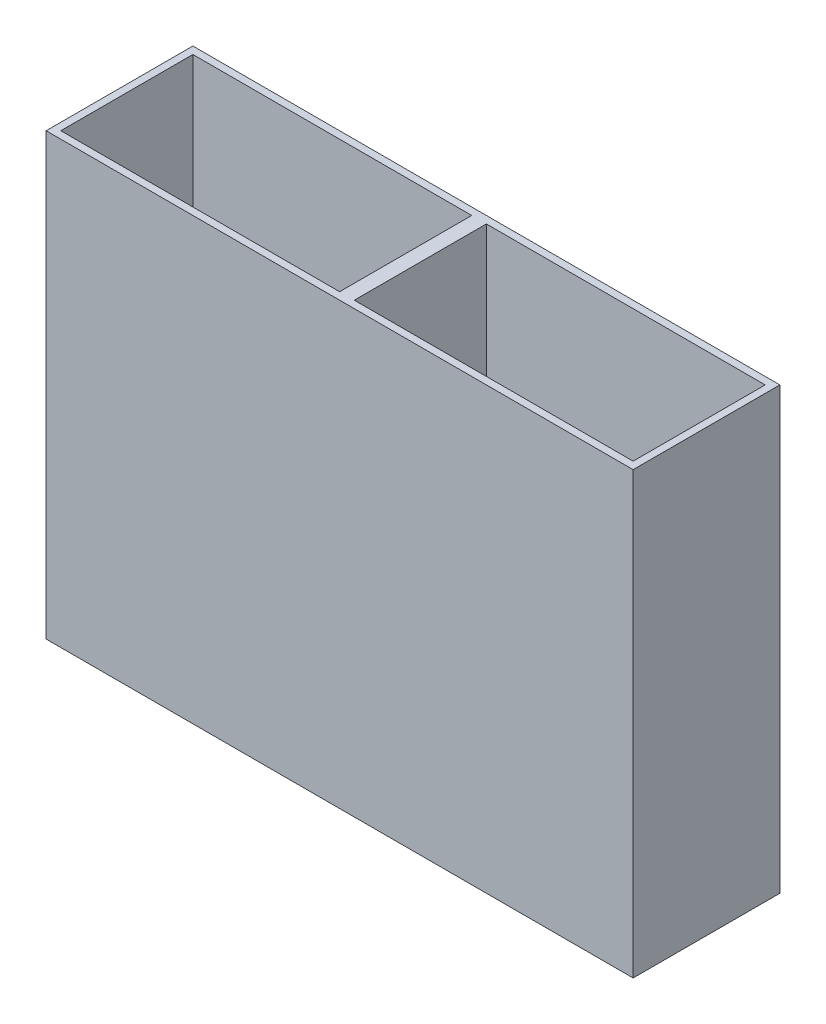
from build123d import *

# Parameters (mm, degrees)
SKETCH1_W           = 508
SKETCH1_H           = 127
BOSS_EXTRUDE1_DEPTH = 381
SKETCH2_W           = 241.3
SKETCH2_H           = 114.3
CUT_EXTRUDE1_DEPTH  = 379.73


with BuildPart() as part:
    # Sketch1 → Boss-Extrude1 (new body)
    with BuildSketch(Plane(origin=(0, 0, 0), x_dir=(1, 0, 0), z_dir=(0, 1, 0))):
        Rectangle(SKETCH1_W, SKETCH1_H)
    extrude(amount=BOSS_EXTRUDE1_DEPTH)

    # Sketch2 → Cut-Extrude1 (cut)
    with BuildSketch(Plane(origin=(0, 381, 0), x_dir=(1, 0, 0), z_dir=(0, 1, 0))):
        with Locations((127, 0)):
            Rectangle(SKETCH2_W, SKETCH2_H)
        with Locations((-127, 0)):
            Rectangle(SKETCH2_W, SKETCH2_H)
    extrude(amount=-CUT_EXTRUDE1_DEPTH, mode=Mode.SUBTRACT)


solid = part.part
